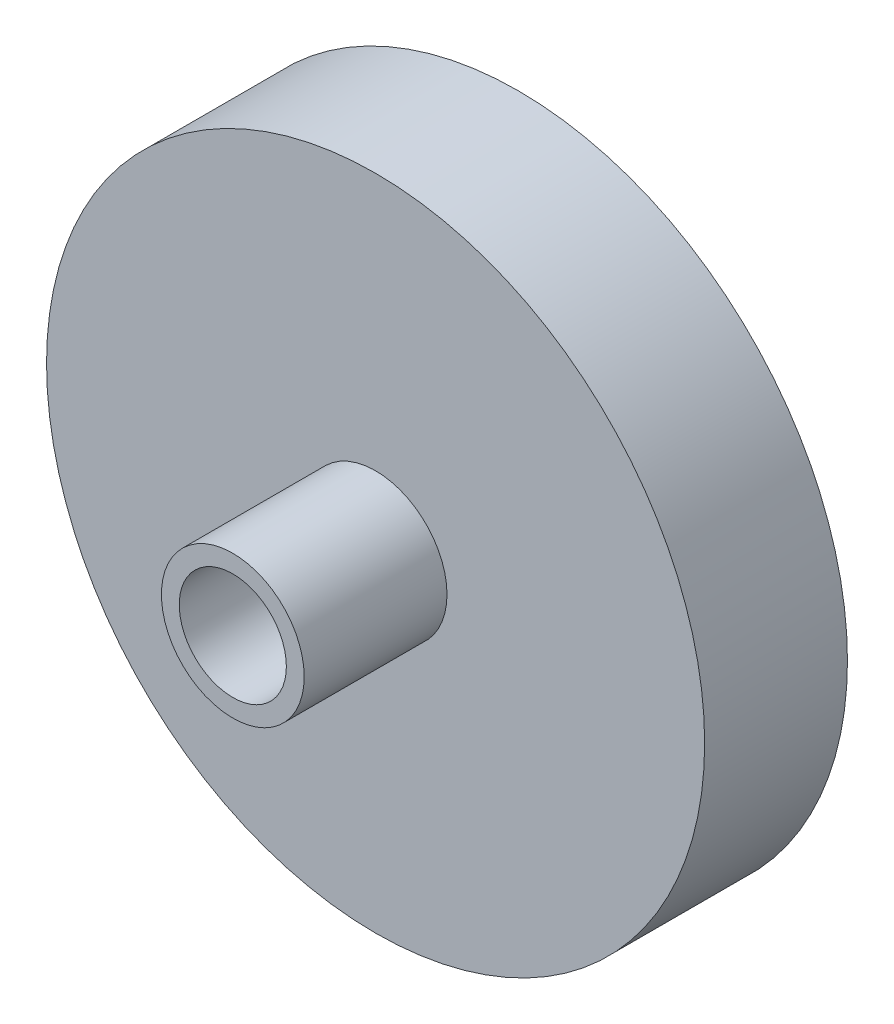
from build123d import *

# Parameters (mm, degrees)
ESQUISSE1_R             = 46.089645319
BOSS_EXTRU_1_DEPTH      = 20
ESQUISSE2_R             = 10
BOSS_EXTRU_2_DEPTH      = 20
ESQUISSE3_R             = 7.5
ENL_V_MAT_EXTRU_1_DEPTH = 20


with BuildPart() as part:
    # Esquisse1 → Boss.-Extru.1 (new body)
    with BuildSketch(Plane.XY):
        Circle(ESQUISSE1_R)
    extrude(amount=BOSS_EXTRU_1_DEPTH)

    # Esquisse2 → Boss.-Extru.2 (add)
    with BuildSketch(Plane.XY.offset(20)):
        Circle(ESQUISSE2_R)
    extrude(amount=BOSS_EXTRU_2_DEPTH)

    # Esquisse3 → Enlèv. mat.-Extru.1 (cut)
    with BuildSketch(Plane.XY.offset(40)):
        Circle(ESQUISSE3_R)
    extrude(amount=-ENL_V_MAT_EXTRU_1_DEPTH, mode=Mode.SUBTRACT)


solid = part.part
